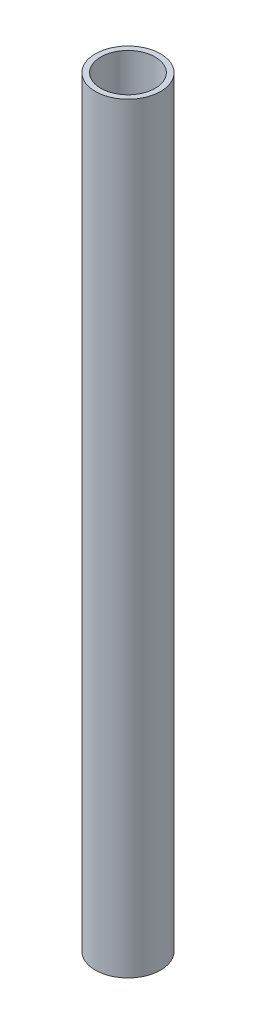
from build123d import *

# Parameters (mm, degrees)
SKETCH_1_R      = 15
SKETCH_1_R_2    = 12.5
EXTRUDE_1_DEPTH = 350


with BuildPart() as part:
    # Эскиз1 → Вытянуть1 (new body)
    with BuildSketch(Plane(origin=(0, 0, 0), x_dir=(1, 0, 0), z_dir=(0, 1, 0))):
        with Locations(Location((0, 0, 0), (0, 0, 270))):
            Circle(SKETCH_1_R)
        with Locations(Location((0, 0, 0), (0, 0, 270))):
            Circle(SKETCH_1_R_2, mode=Mode.SUBTRACT)
    extrude(amount=EXTRUDE_1_DEPTH)


solid = part.part
